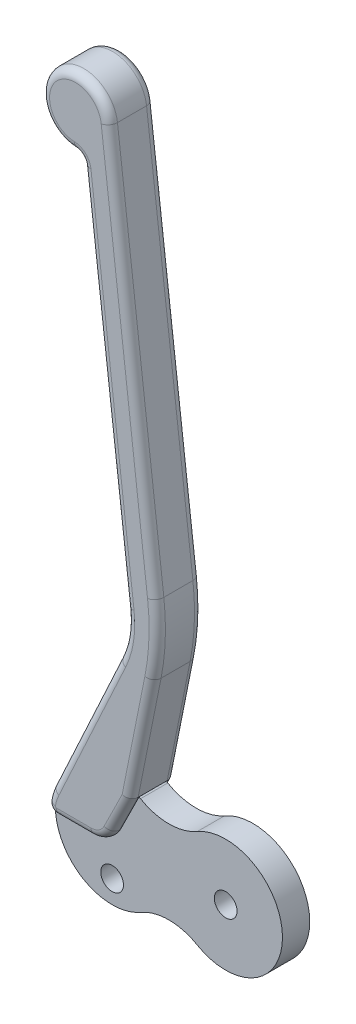
from build123d import *

# Parameters (mm, degrees)
SKETCH1_R           = 2.5
BOSS_EXTRUDE1_DEPTH = 3
BOSS_EXTRUDE2_DEPTH = 5
FILLET1_R           = 1.8


with BuildPart() as part:
    # Sketch1 → Boss-Extrude1 (new, symmetric)
    with BuildSketch(Plane(origin=(0, 0, 0), x_dir=(0, 1, 0), z_dir=(0, 0, 1))):
        with BuildLine():
            ThreePointArc((-10.825318, 6.25), (0, -12.5), (10.825318, 6.25))
            ThreePointArc((10.825318, 6.25), (9.150635, 12.5), (10.825318, 18.75))
            ThreePointArc((10.825318, 18.75), (0, 37.5), (-10.825318, 18.75))
            ThreePointArc((-10.825318, 18.75), (-9.150635, 12.5), (-10.825318, 6.25))
        make_face()
        with Locations(Location((0, 0, 0), (0, 0, 270))):
            Circle(SKETCH1_R, mode=Mode.SUBTRACT)
        with Locations(Location((-7.5, 25, 0), (0, 0, 270))):
            Circle(SKETCH1_R, mode=Mode.SUBTRACT)
    extrude(amount=BOSS_EXTRUDE1_DEPTH, both=True)

    # Sketch2 → Boss-Extrude2 (add, symmetric)
    with BuildSketch(Plane(origin=(0, 0, 0), x_dir=(0, 1, 0), z_dir=(0, 0, 1))):
        with BuildLine():
            ThreePointArc((0, 35.307764), (0.727582, 36.850798), (2.380952, 37.271148))
            ThreePointArc((2.380952, 37.271148), (3.841576, 36.895053), (5.24627, 36.345777))
            Line((5.24627, 36.345777), (36.995968, 21.664764))
            ThreePointArc((36.995968, 21.664764), (42.261052, 20.064281), (47.763018, 19.959286))
            Line((47.763018, 19.959286), (127.25476, 29.458153))
            ThreePointArc((127.25476, 29.458153), (128.486622, 30.086985), (129.015888, 31.364792))
            ThreePointArc((129.015888, 31.364792), (141.598901, 36.577029), (137.399882, 23.620645))
            Line((137.399882, 23.620645), (51.992546, 13.414894))
            ThreePointArc((51.992546, 13.414894), (44.103222, 13.1), (36.262693, 14.030963))
            Line((36.262693, 14.030963), (11.019597, 19.075031))
            Line((11.019597, 19.075031), (2.780641, 23.156138))
            ThreePointArc((2.780641, 23.156138), (0.751659, 25), (0, 27.636589))
            Line((0, 27.636589), (0, 35.307764))
        make_face()
    extrude(amount=BOSS_EXTRUDE2_DEPTH, both=True)

    # Fillet1
    fillet1_edges = [part.edges().sort_by_distance(p)[0] for p in [
        (-36.850798, 0.727582, 5),
        (-21.115584, 6.900119, -5),
        (-31.472177, 0, -5),
        (-25, 0.751659, -5),
        (-16.552997, 23.641145, 5),
        (-13.1, 44.103222, -5),
        (-18.51777, 94.696214, -5),
        (-36.577029, 141.598901, -5),
        (-30.086985, 128.486622, 5),
        (-24.70872, 87.508889, 5),
        (-20.064281, 42.261052, 5),
        (-29.00527, 21.121119, 5),
        (-36.895053, 3.841576, -5),
        (-31.472177, 0, 5),
        (-25, 0.751659, 5),
        (-21.115584, 6.900119, 5),
        (-13.1, 44.103222, 5),
        (-18.51777, 94.696214, 5),
        (-36.577029, 141.598901, 5),
        (-36.895053, 3.841576, 5),
        (-36.850798, 0.727582, -5),
        (-29.00527, 21.121119, -5),
        (-20.064281, 42.261052, -5),
        (-24.70872, 87.508889, -5),
        (-30.086985, 128.486622, -5),
        (-16.552997, 23.641145, -5),
    ]]
    fillet(fillet1_edges, radius=FILLET1_R)


solid = part.part
